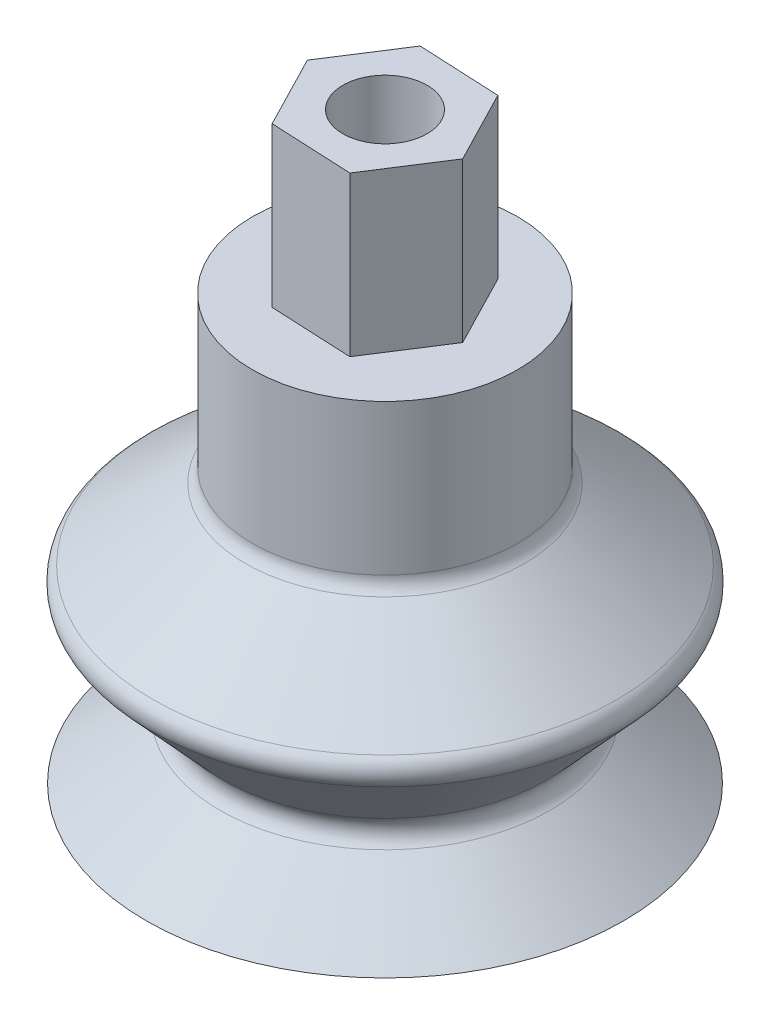
from build123d import *

# Parameters (mm, degrees)
CASCA1_T                 = -0.9
RESSALTO_EXTRUS_O1_DEPTH = 9
FILETE1_R                = 1
ESBO_O3_R                = 2.38125
CORTE_EXTRUS_O1_DEPTH    = 39.143338529
SCALE1_SCALE             = 1.036484245


with BuildPart() as part:
    # Esboço1 → Revolução1 (revolve)
    with BuildSketch(Plane.XY, mode=Mode.PRIVATE) as revolu_o1_sk:
        Polygon((0, 0), (13.5, 0), (8.5, 4), (14, 10), (7.5, 15), (7.5, 24), (0, 24), align=None)
    revolve(revolu_o1_sk.sketch.rotate(Axis((0, 24, 0), (0, -1, 0)), 180), axis=Axis((0, 24, 0), (0, -1, 0)))

    # Casca1
    casca1_openings = [part.faces().sort_by_distance(p)[0] for p in [
        (0, 0, 0),
    ]]
    offset(amount=CASCA1_T, openings=casca1_openings, kind=Kind.INTERSECTION)

    # Esboço2 → Ressalto-extrusão1 (add)
    with BuildSketch(Plane(origin=(0, 24, 0), x_dir=(1, 0, 0), z_dir=(0, 1, 0))):
        Polygon((2.496763598, 3.885808136), (-2.11682676, 4.105164771), (-4.613590359, 0.219356636), (-2.496763598, -3.885808136), (2.11682676, -4.105164771), (4.613590359, -0.219356636), align=None)
    extrude(amount=RESSALTO_EXTRUS_O1_DEPTH)

    # Filete1
    filete1_edges = [part.edges().sort_by_distance(p)[0] for p in [
        (7.5, 15, 0),
        (14, 10, 0),
        (8.5, 4, 0),
    ]]
    fillet(filete1_edges, radius=FILETE1_R)

    # Esboço3 → Corte-extrusão1 (cut, through all)
    with BuildSketch(Plane(origin=(0, 33, 0), x_dir=(1, 0, 0), z_dir=(0, 1, 0))):
        with Locations(Location((0, 0, 0), (0, 0, 270))):
            Circle(ESBO_O3_R)
    extrude(amount=-CORTE_EXTRUS_O1_DEPTH, mode=Mode.SUBTRACT)


with BuildPart() as part_1:
    # Scale1: scaled about (0, 0, 0)
    add(part.part.scale(SCALE1_SCALE))


solid = part_1.part
